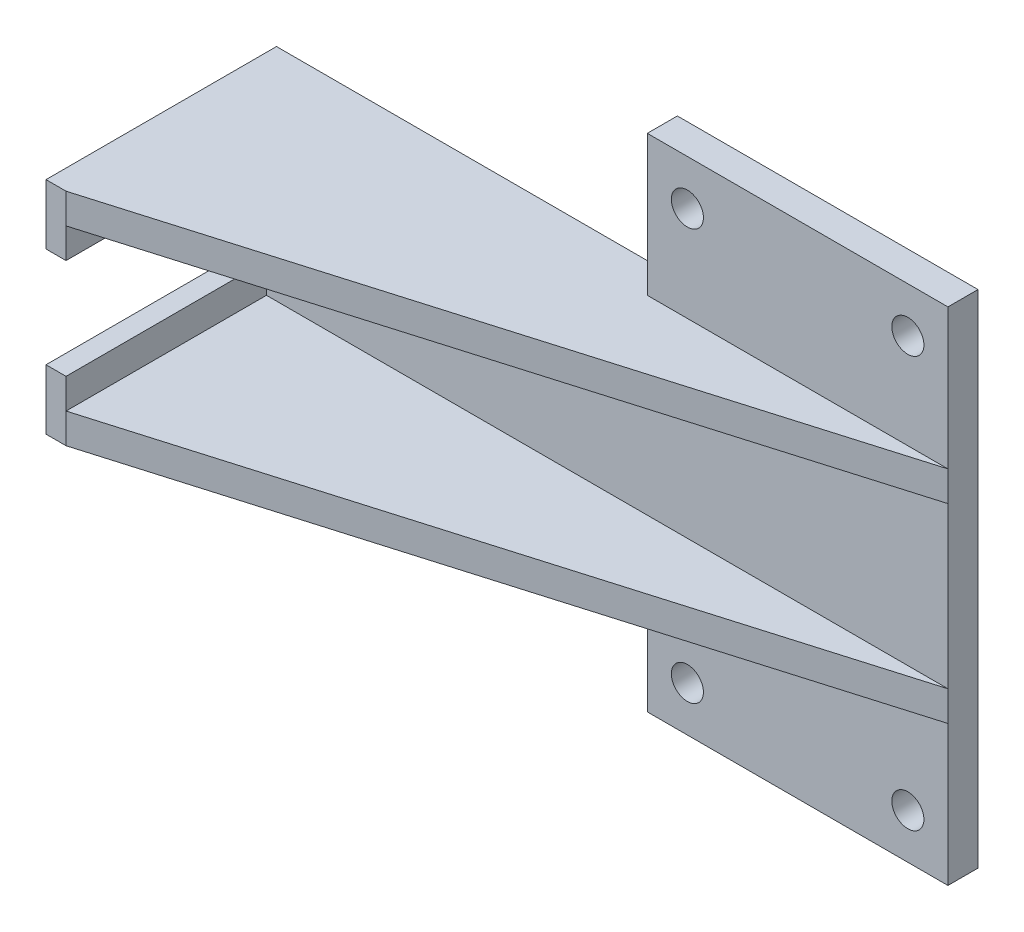
from build123d import *

# Parameters (mm, degrees)
SKETCH_1_R      = 1.6
EXTRUDE_1_DEPTH = 3
SKETCH_5_W      = 2
SKETCH_5_H      = 3
EXTRUDE_3_DEPTH = 20
EXTRUDE_4_DEPTH = 3


with BuildPart() as part:
    # 草图1 → 凸台-拉伸1 (new body)
    with BuildSketch(Plane.XY):
        Polygon((-10, 10), (-40, 10), (-40, -7), (-80, -7), (-80, -23), (-40, -23), (-40, -40), (-10, -40), align=None)
        with Locations((-14, -35.5)):
            Circle(SKETCH_1_R, mode=Mode.SUBTRACT)
        with Locations((-36, 5.5)):
            Circle(SKETCH_1_R, mode=Mode.SUBTRACT)
        with Locations((-36, -35.5)):
            Circle(SKETCH_1_R, mode=Mode.SUBTRACT)
        with Locations((-14, 5.5)):
            Circle(SKETCH_1_R, mode=Mode.SUBTRACT)
    extrude(amount=EXTRUDE_1_DEPTH)

    # 草图5 → 凸台-拉伸3 (add)
    with BuildSketch(Plane.XY.offset(3)):
        with Locations((-79, -21.5)):
            Rectangle(SKETCH_5_W, SKETCH_5_H)
        with Locations((-79, -8.5)):
            Rectangle(SKETCH_5_W, SKETCH_5_H)
    extrude(amount=EXTRUDE_3_DEPTH)

    # 草图7 → 凸台-拉伸4 (add)
    with BuildSketch(Plane(origin=(0, -7, 0), x_dir=(1, 0, 0), z_dir=(0, 1, 0))):
        Polygon((-78, -23), (-10, -3), (-40, -3), (-40, 0), (-80, 0), (-80, -23), align=None)
    extrude_4 = extrude(amount=EXTRUDE_4_DEPTH)

    # 镜向1: 凸台-拉伸4 across plane
    add(extrude_4.mirror(Plane(origin=(0, -15, 0), x_dir=(0, 0, 1), z_dir=(0, -1, 0))))


solid = part.part
